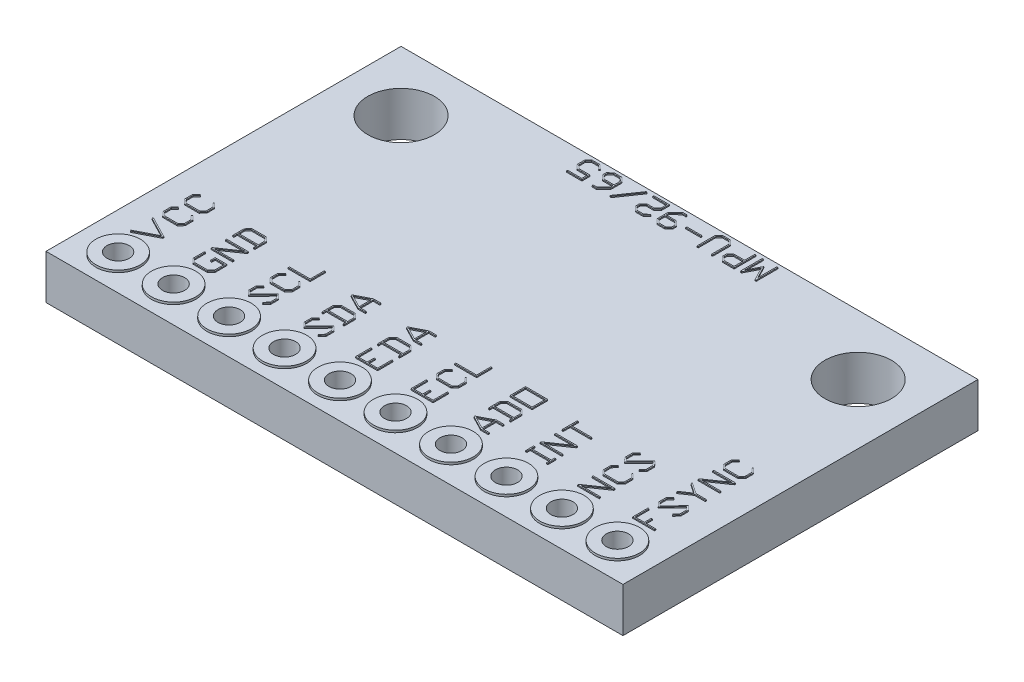
from build123d import *

# Parameters (mm, degrees)
CROQUIS1_W              = 26
CROQUIS1_H              = 16
CROQUIS1_R              = 1.5
SALIENTE_EXTRUIR1_DEPTH = 2
CROQUIS1_3_R            = 0.5
CORTAR_EXTRUIR1_DEPTH   = 2
SALIENTE_EXTRUIR2_START = 0.1
CROQUIS1_4_R            = 1
CROQUIS1_4_R_2          = 0.5
SALIENTE_EXTRUIR2_DEPTH = 0.1
CROQUIS2_W              = 1
CROQUIS2_H              = 0.706459847
CROQUIS2_W_2            = 0.894561163
CROQUIS2_H_2            = 0.596505007
SALIENTE_EXTRUIR5_DEPTH = 0.05
CROQUIS6_W              = 0.684468879
CROQUIS6_H              = 0.053602984
SALIENTE_EXTRUIR6_DEPTH = 0.05


with BuildPart() as part:
    # Croquis1 → Saliente-Extruir1 (new body)
    with BuildSketch(Plane(origin=(0, 0, 0), x_dir=(1, 0, 0), z_dir=(0, 1, 0))):
        Rectangle(CROQUIS1_W, CROQUIS1_H)
        with Locations((-10.3, 5.3)):
            Circle(CROQUIS1_R, mode=Mode.SUBTRACT)
        with Locations((10.3, 5.3)):
            Circle(CROQUIS1_R, mode=Mode.SUBTRACT)
    extrude(amount=-SALIENTE_EXTRUIR1_DEPTH)

    # Croquis1<3> → Cortar-Extruir1 (cut)
    with BuildSketch(Plane(origin=(0, 0, 0), x_dir=(1, 0, 0), z_dir=(0, 1, 0))):
        with Locations((11.25, -6.5)):
            Circle(CROQUIS1_3_R)
        with Locations((8.75, -6.5)):
            Circle(CROQUIS1_3_R)
        with Locations((6.25, -6.5)):
            Circle(CROQUIS1_3_R)
        with Locations((3.75, -6.5)):
            Circle(CROQUIS1_3_R)
        with Locations((1.25, -6.5)):
            Circle(CROQUIS1_3_R)
        with Locations((-1.25, -6.5)):
            Circle(CROQUIS1_3_R)
        with Locations((-3.75, -6.5)):
            Circle(CROQUIS1_3_R)
        with Locations((-6.25, -6.5)):
            Circle(CROQUIS1_3_R)
        with Locations((-8.75, -6.5)):
            Circle(CROQUIS1_3_R)
        with Locations((-11.25, -6.5)):
            Circle(CROQUIS1_3_R)
    extrude(amount=-CORTAR_EXTRUIR1_DEPTH, mode=Mode.SUBTRACT)

    # Croquis1<4> → Saliente-Extruir2 (add)
    # profile 1 of 10: a face of its own
    with BuildSketch(Plane(origin=(0, 0, 0), x_dir=(1, 0, 0), z_dir=(0, 1, 0)).offset(SALIENTE_EXTRUIR2_START)):
        with Locations((11.25, -6.5)):
            Circle(CROQUIS1_4_R)
        with Locations((11.25, -6.5)):
            Circle(CROQUIS1_4_R_2, mode=Mode.SUBTRACT)
    # profile 2 of 10: a face of its own
    with BuildSketch(Plane(origin=(0, 0, 0), x_dir=(1, 0, 0), z_dir=(0, 1, 0)).offset(SALIENTE_EXTRUIR2_START)):
        with Locations((8.75, -6.5)):
            Circle(CROQUIS1_4_R)
        with Locations((8.75, -6.5)):
            Circle(CROQUIS1_4_R_2, mode=Mode.SUBTRACT)
    # profile 3 of 10: a face of its own
    with BuildSketch(Plane(origin=(0, 0, 0), x_dir=(1, 0, 0), z_dir=(0, 1, 0)).offset(SALIENTE_EXTRUIR2_START)):
        with Locations((6.25, -6.5)):
            Circle(CROQUIS1_4_R)
        with Locations((6.25, -6.5)):
            Circle(CROQUIS1_4_R_2, mode=Mode.SUBTRACT)
    # profile 4 of 10: a face of its own
    with BuildSketch(Plane(origin=(0, 0, 0), x_dir=(1, 0, 0), z_dir=(0, 1, 0)).offset(SALIENTE_EXTRUIR2_START)):
        with Locations((3.75, -6.5)):
            Circle(CROQUIS1_4_R)
        with Locations((3.75, -6.5)):
            Circle(CROQUIS1_4_R_2, mode=Mode.SUBTRACT)
    # profile 5 of 10: a face of its own
    with BuildSketch(Plane(origin=(0, 0, 0), x_dir=(1, 0, 0), z_dir=(0, 1, 0)).offset(SALIENTE_EXTRUIR2_START)):
        with Locations((1.25, -6.5)):
            Circle(CROQUIS1_4_R)
        with Locations((1.25, -6.5)):
            Circle(CROQUIS1_4_R_2, mode=Mode.SUBTRACT)
    # profile 6 of 10: a face of its own
    with BuildSketch(Plane(origin=(0, 0, 0), x_dir=(1, 0, 0), z_dir=(0, 1, 0)).offset(SALIENTE_EXTRUIR2_START)):
        with Locations((-1.25, -6.5)):
            Circle(CROQUIS1_4_R)
        with Locations((-1.25, -6.5)):
            Circle(CROQUIS1_4_R_2, mode=Mode.SUBTRACT)
    # profile 7 of 10: a face of its own
    with BuildSketch(Plane(origin=(0, 0, 0), x_dir=(1, 0, 0), z_dir=(0, 1, 0)).offset(SALIENTE_EXTRUIR2_START)):
        with Locations((-3.75, -6.5)):
            Circle(CROQUIS1_4_R)
        with Locations((-3.75, -6.5)):
            Circle(CROQUIS1_4_R_2, mode=Mode.SUBTRACT)
    # profile 8 of 10: a face of its own
    with BuildSketch(Plane(origin=(0, 0, 0), x_dir=(1, 0, 0), z_dir=(0, 1, 0)).offset(SALIENTE_EXTRUIR2_START)):
        with Locations((-6.25, -6.5)):
            Circle(CROQUIS1_4_R)
        with Locations((-6.25, -6.5)):
            Circle(CROQUIS1_4_R_2, mode=Mode.SUBTRACT)
    # profile 9 of 10: a face of its own
    with BuildSketch(Plane(origin=(0, 0, 0), x_dir=(1, 0, 0), z_dir=(0, 1, 0)).offset(SALIENTE_EXTRUIR2_START)):
        with Locations((-8.75, -6.5)):
            Circle(CROQUIS1_4_R)
        with Locations((-8.75, -6.5)):
            Circle(CROQUIS1_4_R_2, mode=Mode.SUBTRACT)
    # profile 10 of 10: a face of its own
    with BuildSketch(Plane(origin=(0, 0, 0), x_dir=(1, 0, 0), z_dir=(0, 1, 0)).offset(SALIENTE_EXTRUIR2_START)):
        with Locations((-11.25, -6.5)):
            Circle(CROQUIS1_4_R)
        with Locations((-11.25, -6.5)):
            Circle(CROQUIS1_4_R_2, mode=Mode.SUBTRACT)
    saliente_extruir2 = extrude(amount=-SALIENTE_EXTRUIR2_DEPTH)

    # Croquis2 → Saliente-Extruir5 (add)
    # profile 1 of 32: a face of its own
    with BuildSketch(Plane(origin=(0, 0, 0), x_dir=(1, 0, 0), z_dir=(0, 1, 0))):
        Polygon((-11.840020971, -4.319144082), (-10.875167251, -4.817475125), (-10.875167251, -4.861849756), (-11.840020971, -5.358806364), (-11.866527942, -5.311879209), (-10.949975811, -4.839269745), (-11.865938898, -4.367445672), align=None)
    # profile 2 of 32: a face of its own
    with BuildSketch(Plane(origin=(0, 0, 0), x_dir=(1, 0, 0), z_dir=(0, 1, 0))):
        Polygon((-11.040884902, -3.338189831), (-10.865153506, -3.5211861), (-10.865153506, -3.868329238), (-11.038136031, -4.047987593), (-11.690992894, -4.047987593), (-11.865153506, -3.868329238), (-11.865153506, -3.5211861), (-11.688244023, -3.338189831), (-11.65054522, -3.377459417), (-11.812139566, -3.542980721), (-11.812139566, -3.847123662), (-11.670376361, -3.993010173), (-11.058752564, -3.993010173), (-10.917578403, -3.847123662), (-10.917578403, -3.542980721), (-11.078583705, -3.377459417), align=None)
    # profile 3 of 32: a face of its own
    with BuildSketch(Plane(origin=(0, 0, 0), x_dir=(1, 0, 0), z_dir=(0, 1, 0))):
        Polygon((-11.040884902, -2.358020972), (-10.865153506, -2.541017241), (-10.865153506, -2.888160379), (-11.038136031, -3.067818733), (-11.690992894, -3.067818733), (-11.865153506, -2.888160379), (-11.865153506, -2.541017241), (-11.688244023, -2.358020972), (-11.65054522, -2.397290558), (-11.812139566, -2.562811861), (-11.812139566, -2.866954803), (-11.670376361, -3.012841314), (-11.058752564, -3.012841314), (-10.917578403, -2.866954803), (-10.917578403, -2.562811861), (-11.078583705, -2.397290558), align=None)
    # profile 4 of 32: a face of its own
    with BuildSketch(Plane(origin=(0, 0, 0), x_dir=(1, 0, 0), z_dir=(0, 1, 0))):
        Polygon((-8.365153506, -4.485058082), (-8.365153506, -5.011859574), (-8.538136031, -5.191517928), (-9.190992894, -5.191517928), (-9.365153506, -5.011859574), (-9.365153506, -4.496446261), (-9.312139566, -4.496446261), (-9.312139566, -4.990653998), (-9.170376361, -5.136540508), (-8.558752564, -5.136540508), (-8.417578403, -4.990653998), (-8.417578403, -4.540035502), (-8.83776297, -4.540035502), (-8.83776297, -4.692597842), (-8.891365955, -4.692597842), (-8.891365955, -4.485058082), align=None)
    # profile 5 of 32: a face of its own
    with BuildSketch(Plane(origin=(0, 0, 0), x_dir=(1, 0, 0), z_dir=(0, 1, 0))):
        Polygon((-8.375167251, -3.504889222), (-8.375167251, -3.553387161), (-9.251271708, -4.156371649), (-8.375167251, -4.156371649), (-8.375167251, -4.211349069), (-9.353372631, -4.211349069), (-9.354550718, -4.162262087), (-8.478642609, -3.559866642), (-9.354550718, -3.559866642), (-9.354550718, -3.504889222), align=None)
    # profile 6 of 32: a face of its own
    with BuildSketch(Plane(origin=(0, 0, 0), x_dir=(1, 0, 0), z_dir=(0, 1, 0))):
        Polygon((-8.538136031, -2.524720363), (-8.365153506, -2.704378718), (-8.365153506, -3.220577422), (-8.417578403, -3.220577422), (-8.417578403, -3.068211429), (-9.312139566, -3.068211429), (-9.312139566, -3.220577422), (-9.365153506, -3.220577422), (-9.365153506, -2.704378718), (-9.190992894, -2.524720363), align=None)
        Polygon((-8.558752564, -2.579697783), (-9.170376361, -2.579697783), (-9.312139566, -2.726173338), (-9.312139566, -3.013823053), (-8.417578403, -3.013823053), (-8.417578403, -2.726173338), align=None, mode=Mode.SUBTRACT)
    # profile 7 of 32: a face of its own
    with BuildSketch(Plane(origin=(0, 0, 0), x_dir=(1, 0, 0), z_dir=(0, 1, 0))):
        Polygon((-6.048738819, -4.47386625), (-5.865153506, -4.664127392), (-5.865153506, -5.011859574), (-6.040884902, -5.195444887), (-6.078583705, -5.156371649), (-5.917578403, -4.990064954), (-5.917578403, -4.686511056), (-6.048738819, -4.55063829), (-6.680390105, -5.202120717), (-6.865153506, -5.011859574), (-6.865153506, -4.664127392), (-6.688244023, -4.481131123), (-6.65054522, -4.520989753), (-6.812139566, -4.686511056), (-6.812139566, -4.990064954), (-6.680390105, -5.125348677), align=None)
    # profile 8 of 32: a face of its own
    with BuildSketch(Plane(origin=(0, 0, 0), x_dir=(1, 0, 0), z_dir=(0, 1, 0))):
        Polygon((-6.040884902, -3.501551308), (-5.865153506, -3.684547577), (-5.865153506, -4.031690715), (-6.038136031, -4.211349069), (-6.690992894, -4.211349069), (-6.865153506, -4.031690715), (-6.865153506, -3.684547577), (-6.688244023, -3.501551308), (-6.65054522, -3.540820893), (-6.812139566, -3.706342197), (-6.812139566, -4.010485138), (-6.670376361, -4.156371649), (-6.058752564, -4.156371649), (-5.917578403, -4.010485138), (-5.917578403, -3.706342197), (-6.078583705, -3.540820893), align=None)
    # profile 9 of 32: a face of its own
    with BuildSketch(Plane(origin=(0, 0, 0), x_dir=(1, 0, 0), z_dir=(0, 1, 0))):
        Polygon((-5.865153506, -2.536108543), (-5.865153506, -3.23118021), (-6.854550718, -3.23118021), (-6.854550718, -3.17620279), (-5.917578403, -3.17620279), (-5.917578403, -2.536108543), align=None)
    # profile 10 of 32: a face of its own
    with BuildSketch(Plane(origin=(0, 0, 0), x_dir=(1, 0, 0), z_dir=(0, 1, 0))):
        Polygon((-3.548738819, -4.47386625), (-3.365153506, -4.664127392), (-3.365153506, -5.011859574), (-3.540884902, -5.195444887), (-3.578583705, -5.156371649), (-3.417578403, -4.990064954), (-3.417578403, -4.686511056), (-3.548738819, -4.55063829), (-4.180390105, -5.202120717), (-4.365153506, -5.011859574), (-4.365153506, -4.664127392), (-4.188244023, -4.481131123), (-4.15054522, -4.520989753), (-4.312139566, -4.686511056), (-4.312139566, -4.990064954), (-4.180390105, -5.125348677), align=None)
    # profile 11 of 32: a face of its own
    with BuildSketch(Plane(origin=(0, 0, 0), x_dir=(1, 0, 0), z_dir=(0, 1, 0))):
        Polygon((-3.538136031, -3.504889222), (-3.365153506, -3.684547577), (-3.365153506, -4.200746281), (-3.417578403, -4.200746281), (-3.417578403, -4.048380289), (-4.312139566, -4.048380289), (-4.312139566, -4.200746281), (-4.365153506, -4.200746281), (-4.365153506, -3.684547577), (-4.190992894, -3.504889222), align=None)
        Polygon((-3.558752564, -3.559866642), (-4.170376361, -3.559866642), (-4.312139566, -3.706342197), (-4.312139566, -3.993991912), (-3.417578403, -3.993991912), (-3.417578403, -3.706342197), align=None, mode=Mode.SUBTRACT)
    # profile 12 of 32: a face of its own
    with BuildSketch(Plane(origin=(0, 0, 0), x_dir=(1, 0, 0), z_dir=(0, 1, 0))):
        Polygon((-3.375167251, -2.524720363), (-3.375167251, -2.579697783), (-3.680684627, -2.579697783), (-3.680684627, -3.17620279), (-3.375167251, -3.17620279), (-3.375167251, -3.23118021), (-3.713082036, -3.23118021), (-4.354550718, -2.900530298), (-4.354550718, -2.855370275), (-3.713082036, -2.524720363), align=None)
        Polygon((-3.733109524, -2.596387357), (-4.279153114, -2.877950287), (-3.733109524, -3.159709564), align=None, mode=Mode.SUBTRACT)
    # profile 13 of 32: a face of its own
    with BuildSketch(Plane(origin=(0, 0, 0), x_dir=(1, 0, 0), z_dir=(0, 1, 0))):
        Polygon((-0.865153506, -4.496446261), (-0.865153506, -5.191517928), (-1.865153506, -5.191517928), (-1.865153506, -4.496446261), (-1.812139566, -4.496446261), (-1.812139566, -5.136540508), (-1.391365955, -5.136540508), (-1.391365955, -4.821794779), (-1.33776297, -4.821794779), (-1.33776297, -5.136540508), (-0.917578403, -5.136540508), (-0.917578403, -4.496446261), align=None)
    # profile 14 of 32: a face of its own
    with BuildSketch(Plane(origin=(0, 0, 0), x_dir=(1, 0, 0), z_dir=(0, 1, 0))):
        Polygon((-1.038136031, -3.504889222), (-0.865153506, -3.684547577), (-0.865153506, -4.200746281), (-0.917578403, -4.200746281), (-0.917578403, -4.048380289), (-1.812139566, -4.048380289), (-1.812139566, -4.200746281), (-1.865153506, -4.200746281), (-1.865153506, -3.684547577), (-1.690992894, -3.504889222), align=None)
        Polygon((-1.058752564, -3.559866642), (-1.670376361, -3.559866642), (-1.812139566, -3.706342197), (-1.812139566, -3.993991912), (-0.917578403, -3.993991912), (-0.917578403, -3.706342197), align=None, mode=Mode.SUBTRACT)
    # profile 15 of 32: a face of its own
    with BuildSketch(Plane(origin=(0, 0, 0), x_dir=(1, 0, 0), z_dir=(0, 1, 0))):
        Polygon((-0.875167251, -2.524720363), (-0.875167251, -2.579697783), (-1.180684627, -2.579697783), (-1.180684627, -3.17620279), (-0.875167251, -3.17620279), (-0.875167251, -3.23118021), (-1.213082036, -3.23118021), (-1.854550718, -2.900530298), (-1.854550718, -2.855370275), (-1.213082036, -2.524720363), align=None)
        Polygon((-1.233109524, -2.596387357), (-1.779153114, -2.877950287), (-1.233109524, -3.159709564), align=None, mode=Mode.SUBTRACT)
    # profile 16 of 32: a face of its own
    with BuildSketch(Plane(origin=(0, 0, 0), x_dir=(1, 0, 0), z_dir=(0, 1, 0))):
        Polygon((1.634846494, -4.496446261), (1.634846494, -5.191517928), (0.634846494, -5.191517928), (0.634846494, -4.496446261), (0.687860434, -4.496446261), (0.687860434, -5.136540508), (1.108634045, -5.136540508), (1.108634045, -4.821794779), (1.16223703, -4.821794779), (1.16223703, -5.136540508), (1.582421597, -5.136540508), (1.582421597, -4.496446261), align=None)
    # profile 17 of 32: a face of its own
    with BuildSketch(Plane(origin=(0, 0, 0), x_dir=(1, 0, 0), z_dir=(0, 1, 0))):
        Polygon((1.459115098, -3.501551308), (1.634846494, -3.684547577), (1.634846494, -4.031690715), (1.461863969, -4.211349069), (0.809007106, -4.211349069), (0.634846494, -4.031690715), (0.634846494, -3.684547577), (0.811755977, -3.501551308), (0.84945478, -3.540820893), (0.687860434, -3.706342197), (0.687860434, -4.010485138), (0.829623639, -4.156371649), (1.441247436, -4.156371649), (1.582421597, -4.010485138), (1.582421597, -3.706342197), (1.421416295, -3.540820893), align=None)
    # profile 18 of 32: a face of its own
    with BuildSketch(Plane(origin=(0, 0, 0), x_dir=(1, 0, 0), z_dir=(0, 1, 0))):
        Polygon((1.634846494, -2.536108543), (1.634846494, -3.23118021), (0.645449282, -3.23118021), (0.645449282, -3.17620279), (1.582421597, -3.17620279), (1.582421597, -2.536108543), align=None)
    # profile 19 of 32: a face of its own
    with BuildSketch(Plane(origin=(0, 0, 0), x_dir=(1, 0, 0), z_dir=(0, 1, 0))):
        Polygon((4.124832749, -4.485058082), (4.124832749, -4.540035502), (3.819315373, -4.540035502), (3.819315373, -5.136540508), (4.124832749, -5.136540508), (4.124832749, -5.191517928), (3.786917964, -5.191517928), (3.145449282, -4.860868017), (3.145449282, -4.815707993), (3.786917964, -4.485058082), align=None)
        Polygon((3.766890476, -4.556725076), (3.220846886, -4.838288005), (3.766890476, -5.120047282), align=None, mode=Mode.SUBTRACT)
    # profile 20 of 32: a face of its own
    with BuildSketch(Plane(origin=(0, 0, 0), x_dir=(1, 0, 0), z_dir=(0, 1, 0))):
        Polygon((3.961863969, -3.504889222), (4.134846494, -3.684547577), (4.134846494, -4.200746281), (4.082421597, -4.200746281), (4.082421597, -4.048380289), (3.187860434, -4.048380289), (3.187860434, -4.200746281), (3.134846494, -4.200746281), (3.134846494, -3.684547577), (3.309007106, -3.504889222), align=None)
        Polygon((3.941247436, -3.559866642), (3.329623639, -3.559866642), (3.187860434, -3.706342197), (3.187860434, -3.993991912), (4.082421597, -3.993991912), (4.082421597, -3.706342197), align=None, mode=Mode.SUBTRACT)
    # profile 21 of 32: a face of its own
    with BuildSketch(Plane(origin=(0, 0, 0), x_dir=(1, 0, 0), z_dir=(0, 1, 0))):
        with Locations((3.634846494, -2.877950286)):
            Rectangle(CROQUIS2_W, CROQUIS2_H)
        with Locations((3.635141016, -2.877950286)):
            Rectangle(CROQUIS2_W_2, CROQUIS2_H_2, mode=Mode.SUBTRACT)
    # profile 22 of 32: a face of its own
    with BuildSketch(Plane(origin=(0, 0, 0), x_dir=(1, 0, 0), z_dir=(0, 1, 0))):
        Polygon((6.634846494, -4.658433303), (6.634846494, -5.017553664), (6.582421597, -5.017553664), (6.582421597, -4.865187671), (5.687860434, -4.865187671), (5.687860434, -5.017553664), (5.634846494, -5.017553664), (5.634846494, -4.658433303), (5.687860434, -4.658433303), (5.687860434, -4.810799295), (6.582421597, -4.810799295), (6.582421597, -4.658433303), align=None)
    # profile 23 of 32: a face of its own
    with BuildSketch(Plane(origin=(0, 0, 0), x_dir=(1, 0, 0), z_dir=(0, 1, 0))):
        Polygon((6.624832749, -3.668250699), (6.624832749, -3.716748637), (5.748728292, -4.319733126), (6.624832749, -4.319733126), (6.624832749, -4.374710546), (5.646627369, -4.374710546), (5.645449282, -4.325623564), (6.521357391, -3.723228119), (5.645449282, -3.723228119), (5.645449282, -3.668250699), align=None)
    # profile 24 of 32: a face of its own
    with BuildSketch(Plane(origin=(0, 0, 0), x_dir=(1, 0, 0), z_dir=(0, 1, 0))):
        Polygon((5.687860434, -2.69947002), (5.687860434, -3.014215749), (6.624832749, -3.014215749), (6.624832749, -3.069193169), (5.687860434, -3.069193169), (5.687860434, -3.383938898), (5.634846494, -3.383938898), (5.634846494, -2.69947002), align=None)
    # profile 25 of 32: a face of its own
    with BuildSketch(Plane(origin=(0, 0, 0), x_dir=(1, 0, 0), z_dir=(0, 1, 0))):
        Polygon((9.124832749, -4.485058082), (9.124832749, -4.53355602), (8.248728292, -5.136540508), (9.124832749, -5.136540508), (9.124832749, -5.191517928), (8.146627369, -5.191517928), (8.145449282, -5.142430946), (9.021357391, -4.540035502), (8.145449282, -4.540035502), (8.145449282, -4.485058082), align=None)
    # profile 26 of 32: a face of its own
    with BuildSketch(Plane(origin=(0, 0, 0), x_dir=(1, 0, 0), z_dir=(0, 1, 0))):
        Polygon((8.959115098, -3.501551308), (9.134846494, -3.684547577), (9.134846494, -4.031690715), (8.961863969, -4.211349069), (8.309007106, -4.211349069), (8.134846494, -4.031690715), (8.134846494, -3.684547577), (8.311755977, -3.501551308), (8.34945478, -3.540820893), (8.187860434, -3.706342197), (8.187860434, -4.010485138), (8.329623639, -4.156371649), (8.941247436, -4.156371649), (9.082421597, -4.010485138), (9.082421597, -3.706342197), (8.921416295, -3.540820893), align=None)
    # profile 27 of 32: a face of its own
    with BuildSketch(Plane(origin=(0, 0, 0), x_dir=(1, 0, 0), z_dir=(0, 1, 0))):
        Polygon((8.951261181, -2.513528531), (9.134846494, -2.703789674), (9.134846494, -3.051521855), (8.959115098, -3.235107169), (8.921416295, -3.196033931), (9.082421597, -3.029727235), (9.082421597, -2.726173338), (8.951261181, -2.590300571), (8.319609895, -3.241782998), (8.134846494, -3.051521855), (8.134846494, -2.703789674), (8.311755977, -2.520793405), (8.34945478, -2.560652034), (8.187860434, -2.726173338), (8.187860434, -3.029727235), (8.319609895, -3.165010958), align=None)
    # profile 28 of 32: a face of its own
    with BuildSketch(Plane(origin=(0, 0, 0), x_dir=(1, 0, 0), z_dir=(0, 1, 0))):
        Polygon((10.687860434, -4.503797162), (10.687860434, -5.143891409), (11.108634045, -5.143891409), (11.108634045, -4.82914568), (11.16223703, -4.82914568), (11.16223703, -5.143891409), (11.624832749, -5.143891409), (11.624832749, -5.198868829), (10.634846494, -5.198868829), (10.634846494, -4.503797162), align=None)
    # profile 29 of 32: a face of its own
    with BuildSketch(Plane(origin=(0, 0, 0), x_dir=(1, 0, 0), z_dir=(0, 1, 0))):
        Polygon((11.451261181, -3.501048291), (11.634846494, -3.691309434), (11.634846494, -4.039041615), (11.459115098, -4.222626929), (11.421416295, -4.183553691), (11.582421597, -4.017246995), (11.582421597, -3.713693098), (11.451261181, -3.577820331), (10.819609895, -4.229302758), (10.634846494, -4.039041615), (10.634846494, -3.691309434), (10.811755977, -3.508313165), (10.84945478, -3.548171794), (10.687860434, -3.713693098), (10.687860434, -4.017246995), (10.819609895, -4.152530718), align=None)
    # profile 30 of 32: a face of its own
    with BuildSketch(Plane(origin=(0, 0, 0), x_dir=(1, 0, 0), z_dir=(0, 1, 0))):
        Polygon((10.660568072, -2.526180826), (11.142994933, -2.858205173), (11.624832749, -2.858205173), (11.624832749, -2.913182593), (11.142994933, -2.913182593), (10.661353464, -3.244421549), (10.634846494, -3.196709002), (11.088017513, -2.885301187), (10.634846494, -2.574482417), align=None)
    # profile 31 of 32: a face of its own
    with BuildSketch(Plane(origin=(0, 0, 0), x_dir=(1, 0, 0), z_dir=(0, 1, 0))):
        Polygon((11.624832749, -1.551902405), (11.624832749, -1.600400343), (10.748728292, -2.203384832), (11.624832749, -2.203384832), (11.624832749, -2.258362252), (10.646627369, -2.258362252), (10.645449282, -2.209275269), (11.521357391, -1.606879825), (10.645449282, -1.606879825), (10.645449282, -1.551902405), align=None)
    # profile 32 of 32: a face of its own
    with BuildSketch(Plane(origin=(0, 0, 0), x_dir=(1, 0, 0), z_dir=(0, 1, 0))):
        Polygon((11.459115098, -0.568395631), (11.634846494, -0.7513919), (11.634846494, -1.098535038), (11.461863969, -1.278193392), (10.809007106, -1.278193392), (10.634846494, -1.098535038), (10.634846494, -0.7513919), (10.811755977, -0.568395631), (10.84945478, -0.607665216), (10.687860434, -0.77318652), (10.687860434, -1.077329462), (10.829623639, -1.223215972), (11.441247436, -1.223215972), (11.582421597, -1.077329462), (11.582421597, -0.77318652), (11.421416295, -0.607665216), align=None)
    extrude(amount=SALIENTE_EXTRUIR5_DEPTH)

    # Croquis6 → Saliente-Extruir6 (add)
    # profile 1 of 9: a face of its own
    with BuildSketch(Plane(origin=(0, 0, 0), x_dir=(1, 0, 0), z_dir=(0, 1, 0))):
        Polygon((3.468427253, 7.805301394), (3.523404673, 7.805301394), (3.523404673, 6.955114864), (3.821657177, 7.533555861), (4.11990968, 6.955114864), (4.11990968, 7.805301394), (4.1748871, 7.805301394), (4.1748871, 6.825917927), (4.125211074, 6.825917927), (3.821657177, 7.413587277), (3.518103279, 6.825917927), (3.468427253, 6.825917927), align=None)
    # profile 2 of 9: a face of its own
    with BuildSketch(Plane(origin=(0, 0, 0), x_dir=(1, 0, 0), z_dir=(0, 1, 0))):
        Polygon((2.488258394, 7.168545062), (2.667916748, 7.342705674), (3.139740821, 7.342705674), (3.139740821, 7.805301394), (3.194718241, 7.805301394), (3.194718241, 6.815315138), (2.667916748, 6.815315138), (2.488258394, 6.989475751), align=None)
        Polygon((2.543235814, 7.147339486), (2.543235814, 7.010092284), (2.689711369, 6.868329079), (3.139740821, 6.868329079), (3.139740821, 7.28910269), (2.689711369, 7.28910269), align=None, mode=Mode.SUBTRACT)
    # profile 3 of 9: a face of its own
    with BuildSketch(Plane(origin=(0, 0, 0), x_dir=(1, 0, 0), z_dir=(0, 1, 0))):
        Polygon((1.508089535, 7.642332613), (1.687747889, 7.815315138), (2.034891027, 7.815315138), (2.214549382, 7.642332613), (2.214549382, 6.825917927), (2.159571962, 6.825917927), (2.159571962, 7.621716081), (2.013685451, 7.762890242), (1.709542509, 7.762890242), (1.563066955, 7.621716081), (1.563066955, 6.825917927), (1.508089535, 6.825917927), align=None)
    # profile 4 of 9: a face of its own
    with BuildSketch(Plane(origin=(0, 0, 0), x_dir=(1, 0, 0), z_dir=(0, 1, 0))):
        with Locations((0.881543295, 7.315904182)):
            Rectangle(CROQUIS6_W, CROQUIS6_H)
    # profile 5 of 9: a face of its own
    with BuildSketch(Plane(origin=(0, 0, 0), x_dir=(1, 0, 0), z_dir=(0, 1, 0))):
        Polygon((-0.452248184, 7.483879835), (-0.109621048, 7.815315138), (0.080640094, 7.815315138), (0.080640094, 7.762890242), (-0.088415472, 7.762890242), (-0.397270764, 7.463263303), (-0.397270764, 7.342705674), (0.074553308, 7.342705674), (0.254211663, 7.168545062), (0.254211663, 6.989475751), (0.074553308, 6.815315138), (-0.272589829, 6.815315138), (-0.452248184, 6.989475751), align=None)
        Polygon((-0.397270764, 7.28910269), (-0.397270764, 7.010092284), (-0.250795209, 6.868329079), (0.053347732, 6.868329079), (0.199234243, 7.010092284), (0.199234243, 7.147339486), (0.053347732, 7.28910269), align=None, mode=Mode.SUBTRACT)
    # profile 6 of 9: a face of its own
    with BuildSketch(Plane(origin=(0, 0, 0), x_dir=(1, 0, 0), z_dir=(0, 1, 0))):
        Polygon((-1.432417043, 7.168545062), (-1.253347732, 7.342705674), (-0.927410171, 7.342705674), (-0.780934616, 7.483879835), (-0.780934616, 7.762890242), (-1.421028863, 7.762890242), (-1.421028863, 7.815315138), (-0.725957196, 7.815315138), (-0.725957196, 7.463263303), (-0.905615551, 7.28910269), (-1.230964068, 7.28910269), (-1.377439623, 7.147339486), (-1.377439623, 7.010092284), (-1.230964068, 6.868329079), (-0.927410171, 6.868329079), (-0.761103475, 7.029923424), (-0.722030238, 6.992224622), (-0.905615551, 6.815315138), (-1.253347732, 6.815315138), (-1.432417043, 6.989475751), align=None)
    # profile 7 of 9: a face of its own
    with BuildSketch(Plane(origin=(0, 0, 0), x_dir=(1, 0, 0), z_dir=(0, 1, 0))):
        Polygon((-2.41847634, 6.841036717), (-1.747948164, 7.815315138), (-1.700235618, 7.789397212), (-2.37017475, 6.815315138), align=None)
    # profile 8 of 9: a face of its own
    with BuildSketch(Plane(origin=(0, 0, 0), x_dir=(1, 0, 0), z_dir=(0, 1, 0))):
        Polygon((-3.392754761, 7.642332613), (-3.213096407, 7.815315138), (-2.865953269, 7.815315138), (-2.686294915, 7.642332613), (-2.686294915, 7.147339486), (-3.02892205, 6.815315138), (-3.218397801, 6.815315138), (-3.218397801, 6.868329079), (-3.050127626, 6.868329079), (-2.741272335, 7.168545062), (-2.741272335, 7.28910269), (-3.213096407, 7.28910269), (-3.392754761, 7.463263303), align=None)
        Polygon((-3.337777341, 7.621716081), (-3.337777341, 7.483879835), (-3.191301787, 7.342705674), (-2.741272335, 7.342705674), (-2.741272335, 7.621716081), (-2.887158845, 7.762890242), (-3.191301787, 7.762890242), align=None, mode=Mode.SUBTRACT)
    # profile 9 of 9: a face of its own
    with BuildSketch(Plane(origin=(0, 0, 0), x_dir=(1, 0, 0), z_dir=(0, 1, 0))):
        Polygon((-4.372923621, 7.642332613), (-4.19385431, 7.815315138), (-3.846122128, 7.815315138), (-3.662536815, 7.639583742), (-3.701610053, 7.60188494), (-3.867916748, 7.762890242), (-4.171470646, 7.762890242), (-4.317946201, 7.621716081), (-4.317946201, 7.325427057), (-4.171470646, 7.184449244), (-3.666463774, 7.184449244), (-3.666463774, 6.815315138), (-4.361535441, 6.815315138), (-4.361535441, 6.868329079), (-3.721441194, 6.868329079), (-3.721441194, 7.130649912), (-4.19385431, 7.130649912), (-4.372923621, 7.305006872), align=None)
    extrude(amount=SALIENTE_EXTRUIR6_DEPTH)

    # Simetría1: Saliente-Extruir2 across plane
    add(saliente_extruir2.mirror(Plane(origin=(0, -1, 0), x_dir=(0, 0, 1), z_dir=(0, -1, 0))))


solid = part.part
